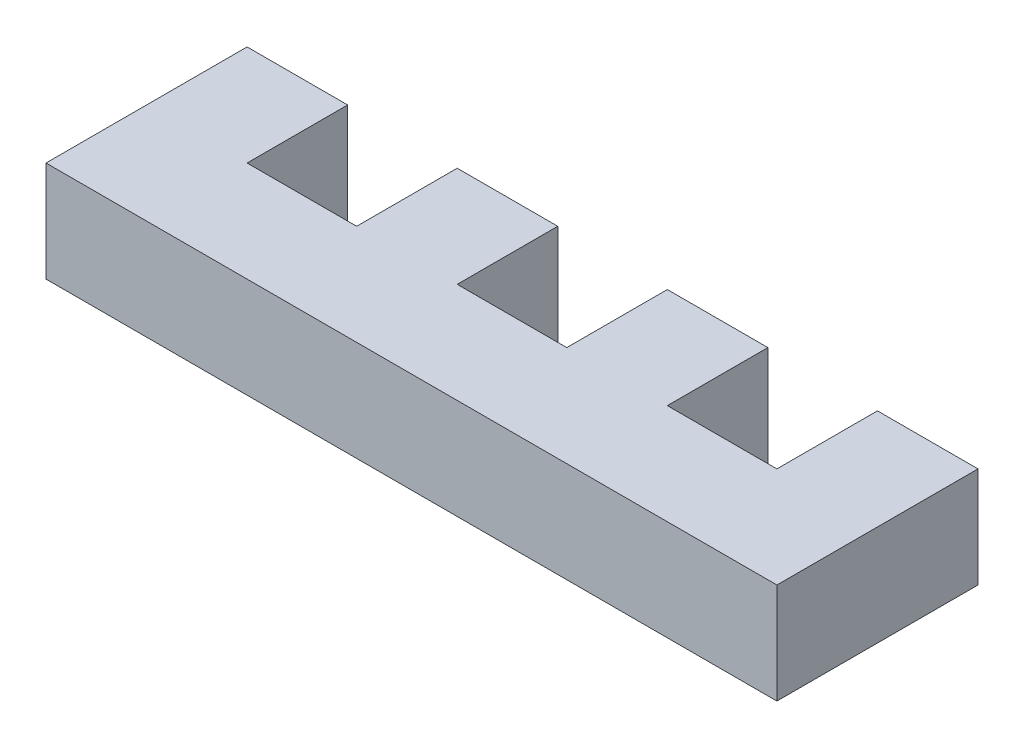
from build123d import *

# Parameters (mm, degrees)
BOSS_EXTRUDE1_DEPTH = 6.35


with BuildPart() as part:
    # Sketch1 → Boss-Extrude1 (new body)
    with BuildSketch(Plane(origin=(0, 0, 0), x_dir=(1, 0, 0), z_dir=(0, 1, 0))):
        Polygon((6.922, 6.35), (6.922, 0), (53.082, 0), (53.082, 6.35), (53.082, 12.7), (52.819416304, 12.7), (46.732, 12.7), (46.732, 6.35), (39.812, 6.35), (39.812, 12.7), (33.462, 12.7), (33.462, 6.35), (26.542, 6.35), (26.542, 12.7), (20.192, 12.7), (20.192, 6.35), (13.272, 6.35), (13.272, 12.7), (6.922, 12.7), align=None)
    extrude(amount=BOSS_EXTRUDE1_DEPTH)


solid = part.part
